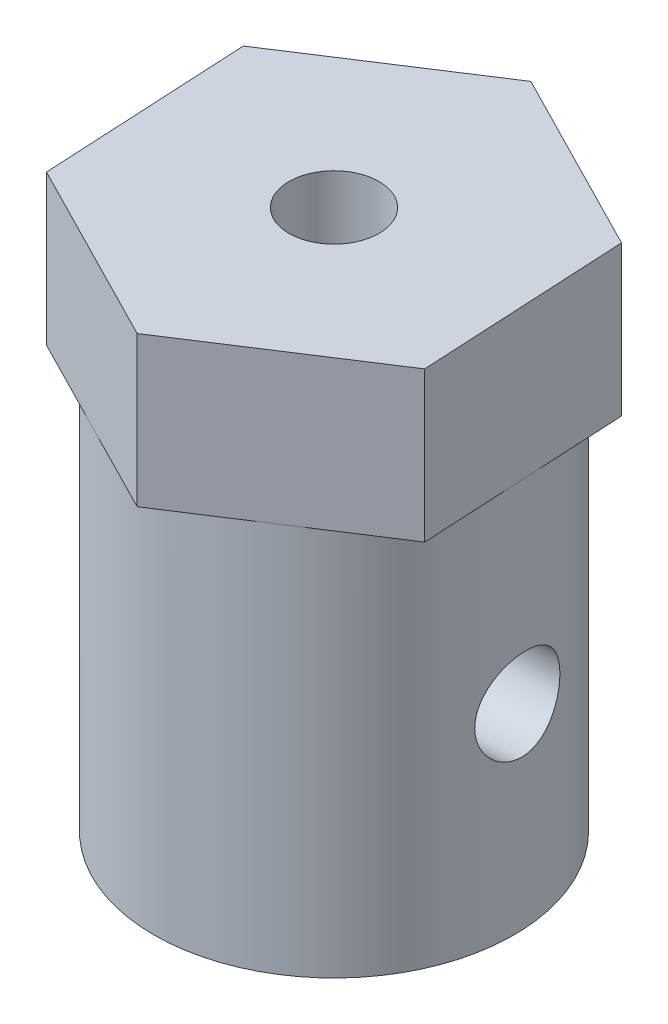
from build123d import *

# Parameters (mm, degrees)
CROQUIS1_R              = 6
CROQUIS1_R_2            = 4
SALIENTE_EXTRUIR1_DEPTH = 13
CROQUIS2_R              = 1.5
SALIENTE_EXTRUIR2_DEPTH = 5
CROQUIS3_R              = 1.5
CORTAR_EXTRUIR1_DEPTH   = 24


with BuildPart() as part:
    # Croquis1 → Saliente-Extruir1 (new body)
    with BuildSketch(Plane(origin=(0, 0, 0), x_dir=(1, 0, 0), z_dir=(0, 1, 0))):
        with Locations(Location((0, 0, 0), (0, 0, 90))):
            Circle(CROQUIS1_R)
        with Locations(Location((0, 0, 0), (0, 0, 90))):
            Circle(CROQUIS1_R_2, mode=Mode.SUBTRACT)
    extrude(amount=SALIENTE_EXTRUIR1_DEPTH)

    # Croquis2 → Saliente-Extruir2 (add)
    with BuildSketch(Plane(origin=(0, 13, 0), x_dir=(1, 0, 0), z_dir=(0, 1, 0))):
        Polygon((6.17109675, -3.149216553), (5.812849912, 3.769718279), (-0.358246838, 6.918934832), (-6.17109675, 3.149216553), (-5.812849912, -3.769718279), (0.358246838, -6.918934832), align=None)
        with Locations(Location((0, 0, 0), (0, 0, 270))):
            Circle(CROQUIS2_R, mode=Mode.SUBTRACT)
    extrude(amount=SALIENTE_EXTRUIR2_DEPTH)

    # Croquis3 → Cortar-Extruir1 (cut)
    with BuildSketch(Plane(origin=(-5.991973331, 0, 0.310250863), x_dir=(0.0517084771330075, 0, 0.9986622218711316), z_dir=(-0.9986622218711316, 0, 0.0517084771330075))):
        with Locations((-0.007268939, 6.5)):
            Circle(CROQUIS3_R)
    extrude(amount=-CORTAR_EXTRUIR1_DEPTH, mode=Mode.SUBTRACT)


solid = part.part
